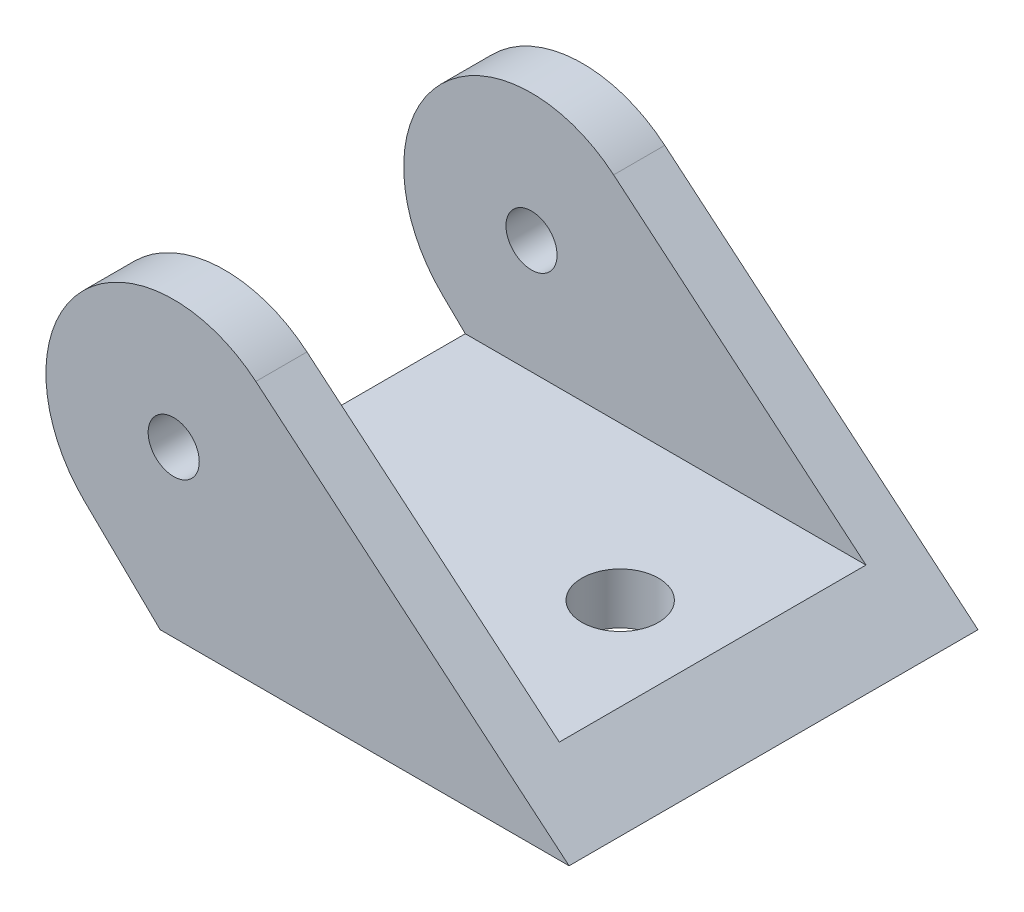
from build123d import *

# Parameters (mm, degrees)
SKETCH1_R           = 3.175
BOSS_EXTRUDE1_DEPTH = 25.4
CUT_EXTRUDE1_START  = 50.8
SKETCH2_W           = 64.994311014
SKETCH2_H           = 38.1
CUT_EXTRUDE1_DEPTH  = 44.45
SKETCH3_R           = 4.7625
CUT_EXTRUDE2_DEPTH  = 65.240638337


with BuildPart() as part:
    # Sketch1 → Boss-Extrude1 (new, symmetric)
    with BuildSketch(Plane.XY):
        with BuildLine():
            Line((0, 0), (-9.376460946, 9.101647163))
            ThreePointArc((-9.376460946, 9.101647163), (-10.10301176, 31.130324977), (11.88494229, 32.653610572))
            Line((11.88494229, 32.653610572), (50.8, 0))
            Line((50.8, 0), (0, 0))
        make_face()
        with Locations((1.680688986, 20.492655038)):
            Circle(SKETCH1_R, mode=Mode.SUBTRACT)
    extrude(amount=BOSS_EXTRUDE1_DEPTH, both=True)

    # Sketch2 → Cut-Extrude1 (cut)
    with BuildSketch(Plane(origin=(0, 0, 0), x_dir=(1, 0, 0), z_dir=(0, 1, 0)).offset(CUT_EXTRUDE1_START)):
        with Locations((18.302844493, 0)):
            Rectangle(SKETCH2_W, SKETCH2_H)
    extrude(amount=-CUT_EXTRUDE1_DEPTH, mode=Mode.SUBTRACT)

    # Sketch3 → Cut-Extrude2 (cut, through all)
    with BuildSketch(Plane(origin=(0, 6.35, 0), x_dir=(1, 0, 0), z_dir=(0, 1, 0))):
        with Locations(Location((31.75, 0, 0), (0, 0, 270))):
            Circle(SKETCH3_R)
    extrude(amount=-CUT_EXTRUDE2_DEPTH, mode=Mode.SUBTRACT)


solid = part.part
